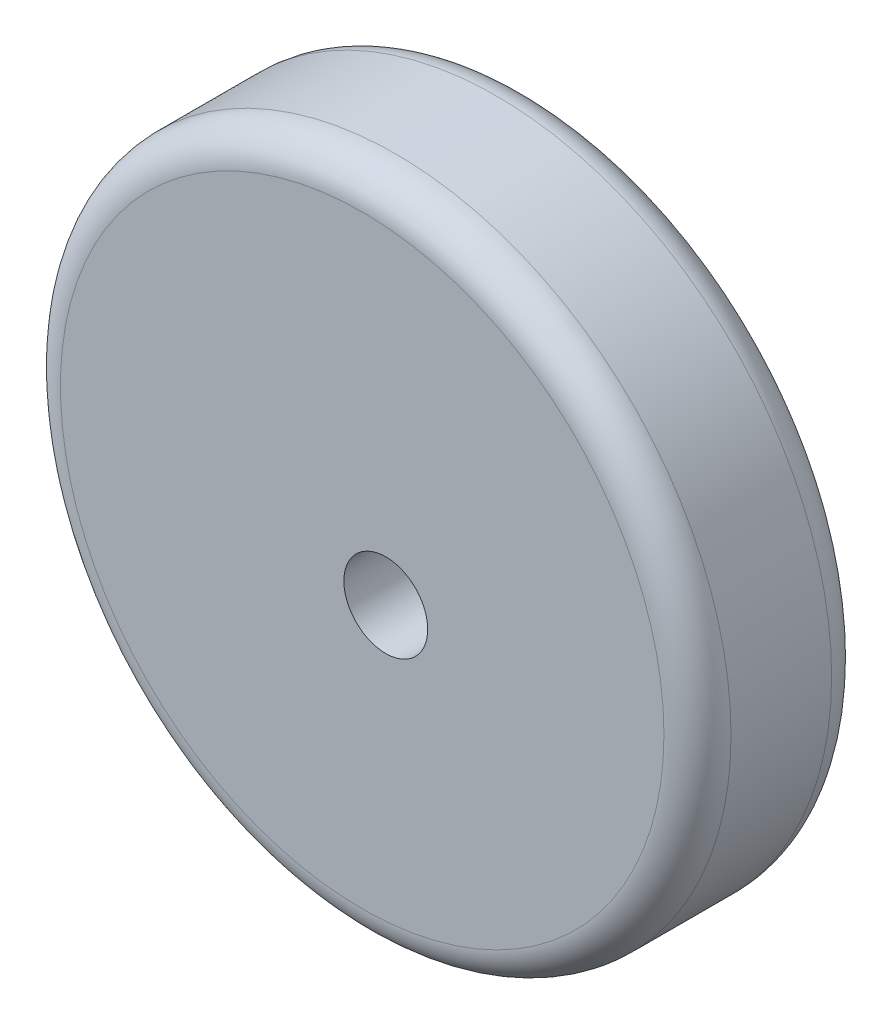
from build123d import *

# Parameters (mm, degrees)
SKETCH1_R                   = 25.4
BOSS_EXTRUDE1_DEPTH         = 12.7
FILLET1_R                   = 2.54
FILLET2_R                   = 2.54
F_1_4_0_25_DIAMETER_HOLE1_D = 6.35


with BuildPart() as part:
    # Sketch1 → Boss-Extrude1 (new body)
    with BuildSketch(Plane.XY):
        with Locations((-30.291010944, 15.918155424)):
            Circle(SKETCH1_R)
    extrude(amount=BOSS_EXTRUDE1_DEPTH)

    # Fillet1
    fillet1_edges = [part.edges().sort_by_distance(p)[0] for p in [
        (-55.691010944, 15.918155424, 12.7),
    ]]
    fillet(fillet1_edges, radius=FILLET1_R)

    # Fillet2
    fillet2_edges = [part.edges().sort_by_distance(p)[0] for p in [
        (-55.691010944, 15.918155424, 0),
    ]]
    fillet(fillet2_edges, radius=FILLET2_R)

    # 1/4 (0.25) Diameter Hole1 (through all)
    with Locations(Plane(origin=(0, 0, 0), x_dir=(-1, 0, 0), z_dir=(0, 0, -1))):
        with Locations((28.50138728, 13.874510617)):
            Hole(F_1_4_0_25_DIAMETER_HOLE1_D / 2)


solid = part.part
